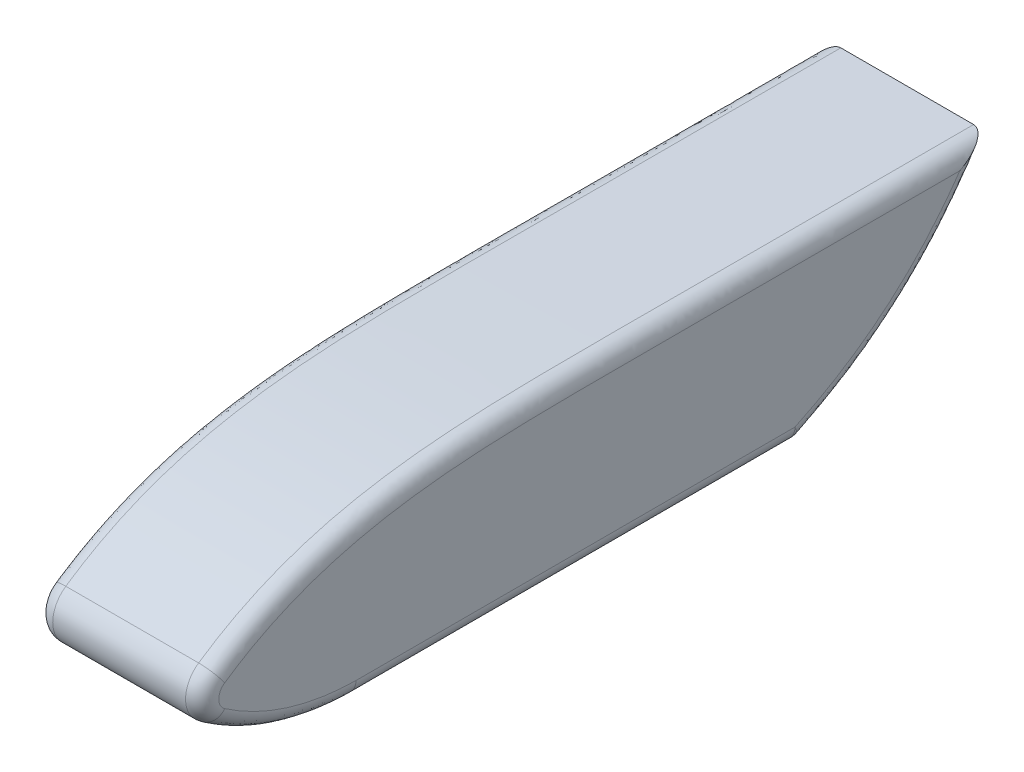
from build123d import *

# Parameters (mm, degrees)
SKETCH1_W           = 150
SKETCH1_H           = 125
BOSS_EXTRUDE1_DEPTH = 400
BOSS_EXTRUDE2_DEPTH = 150
FILLET1_R           = 15


with BuildPart() as part:
    # Sketch1 → Boss-Extrude1 (new body)
    with BuildSketch(Plane.XY):
        with Locations((5.104712042, 9.358638743)):
            Rectangle(SKETCH1_W, SKETCH1_H)
    extrude(amount=BOSS_EXTRUDE1_DEPTH)

    # Sketch2 → Boss-Extrude2 (add)
    with BuildSketch(Plane(origin=(80.104712042, 0, 0), x_dir=(0, 0, -1), z_dir=(1, 0, 0))):
        with BuildLine():
            Line((-400, -53.141361257), (0, -53.141361257))
            add(Edge.make_bspline(
                [(0, -53.141361257), (109.657757417, -2.76599099), (173.063054437, 102.858638743)],
                knots=[0, 0, 0, 1, 1, 1], degree=2))
            add(Edge.make_bspline(
                [(-527.083058108, 31.686270557), (-502.130544308, 48.8156408), (-400.791671341, 99.030121285), (-226.177268831, 103.790992089), (-20.030650849, 102.536192565), (104.776057331, 103.005042445), (173.063054437, 102.858638743)],
                knots=[0, 0, 0, 0, 0.124540201, 0.476334433, 0.711394185, 1, 1, 1, 1], degree=3))
            ThreePointArc((-527.083058108, 31.686270557), (-538.88333751, 9.27245465), (-527.083058108, -13.141361257))
            add(Edge.make_bspline(
                [(-400, -53.141361257), (-445.353522893, -52.497628707), (-488.629563407, -39.538867863), (-527.083058108, -13.141361257)],
                knots=[0, 0, 0, 0, 1, 1, 1, 1], degree=3))
        make_face()
    extrude(amount=-BOSS_EXTRUDE2_DEPTH)

    # Fillet1
    fillet1_edges = [part.edges().sort_by_distance(p)[0] for p in [
        (80.104712042, -42.668235376, 466.548321311),
        (80.104712042, 11.477981034, -98.572691707),
        (80.104712042, 102.961238591, 183.528114028),
        (80.104712042, 9.27245465, 538.88333751),
        (-69.895287958, -42.668235376, 466.548321311),
        (-69.895287958, 9.27245465, 538.88333751),
        (-69.895287958, 102.961238591, 183.528114028),
        (-69.895287958, 11.477981034, -98.572691707),
        (5.104712042, -53.141361257, 0),
        (80.104712042, -53.141361257, 200),
        (-69.895287958, -53.141361257, 200),
    ]]
    fillet(fillet1_edges, radius=FILLET1_R)


solid = part.part
